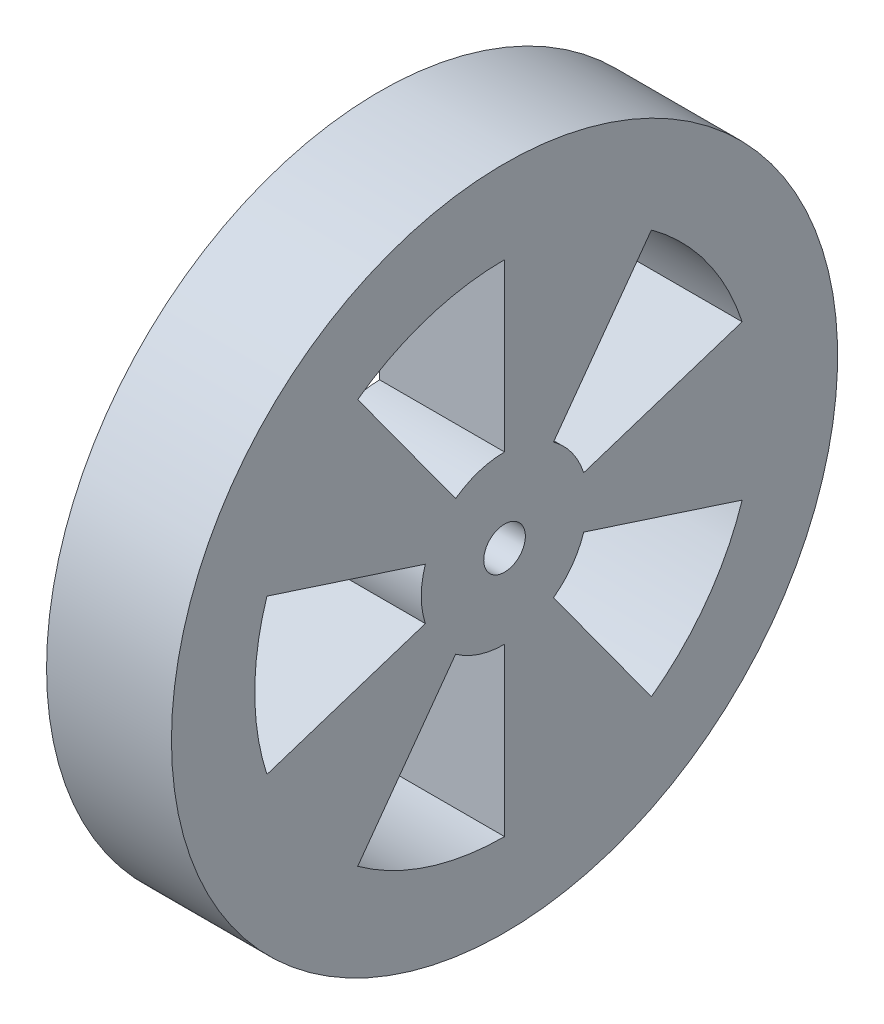
from build123d import *

# Parameters (mm, degrees)
SKETCH1_R           = 50.8
SKETCH1_R_2         = 3.175
BOSS_EXTRUDE1_DEPTH = 19.05


with BuildPart() as part:
    # Sketch1 → Boss-Extrude1 (new body)
    with BuildSketch(Plane(origin=(0, 0, 0), x_dir=(0, 0, -1), z_dir=(1, 0, 0))):
        with Locations(Location((0, 0, 0), (0, 0, 180))):
            Circle(SKETCH1_R)
        with BuildLine():
            Line((0, 38.1), (0, 12.7))
            ThreePointArc((0, 12.7), (-3.924515829, 12.078417757), (-7.464872704, 10.274515829))
            Line((-7.464872704, 10.274515829), (-22.394618112, 30.823547486))
            ThreePointArc((-22.394618112, 30.823547486), (-11.773547486, 36.235253271), (0, 38.1))
        make_face(mode=Mode.SUBTRACT)
        with BuildLine():
            Line((-36.235253271, 11.773547486), (-12.078417757, 3.924515829))
            ThreePointArc((-12.078417757, 3.924515829), (-12.7, 0), (-12.078417757, -3.924515829))
            Line((-12.078417757, -3.924515829), (-36.235253271, -11.773547486))
            ThreePointArc((-36.235253271, -11.773547486), (-38.1, 0), (-36.235253271, 11.773547486))
        make_face(mode=Mode.SUBTRACT)
        with BuildLine():
            Line((-22.394618112, -30.823547486), (-7.464872704, -10.274515829))
            ThreePointArc((-7.464872704, -10.274515829), (-3.924515829, -12.078417757), (0, -12.7))
            Line((0, -12.7), (0, -38.1))
            ThreePointArc((0, -38.1), (-11.773547486, -36.235253271), (-22.394618112, -30.823547486))
        make_face(mode=Mode.SUBTRACT)
        with BuildLine():
            Line((22.394618112, -30.823547486), (7.464872704, -10.274515829))
            ThreePointArc((7.464872704, -10.274515829), (10.274515829, -7.464872704), (12.078417757, -3.924515829))
            Line((12.078417757, -3.924515829), (36.235253271, -11.773547486))
            ThreePointArc((36.235253271, -11.773547486), (30.823547486, -22.394618112), (22.394618112, -30.823547486))
        make_face(mode=Mode.SUBTRACT)
        with BuildLine():
            Line((36.235253271, 11.773547486), (12.078417757, 3.924515829))
            ThreePointArc((12.078417757, 3.924515829), (10.274515829, 7.464872704), (7.464872704, 10.274515829))
            Line((7.464872704, 10.274515829), (22.394618112, 30.823547486))
            ThreePointArc((22.394618112, 30.823547486), (30.823547486, 22.394618112), (36.235253271, 11.773547486))
        make_face(mode=Mode.SUBTRACT)
        with Locations(Location((0, 0, 0), (0, 0, 180))):
            Circle(SKETCH1_R_2, mode=Mode.SUBTRACT)
    extrude(amount=BOSS_EXTRUDE1_DEPTH)


solid = part.part
